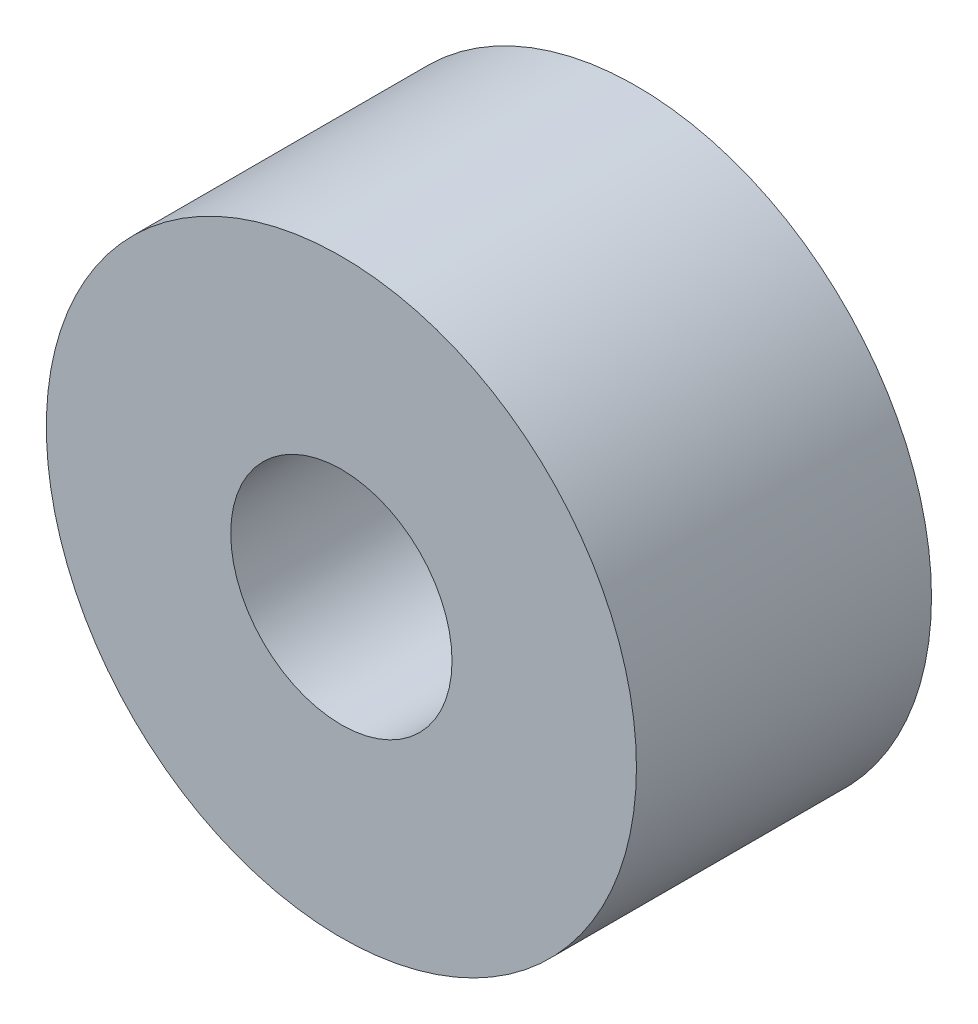
from build123d import *

# Parameters (mm, degrees)
SKETCH1_R           = 6.35
SKETCH1_R_2         = 2.38125
BOSS_EXTRUDE1_DEPTH = 6.35


with BuildPart() as part:
    # Sketch1 → Boss-Extrude1 (new body)
    with BuildSketch(Plane.XY):
        Circle(SKETCH1_R)
        Circle(SKETCH1_R_2, mode=Mode.SUBTRACT)
    extrude(amount=BOSS_EXTRUDE1_DEPTH)


solid = part.part
